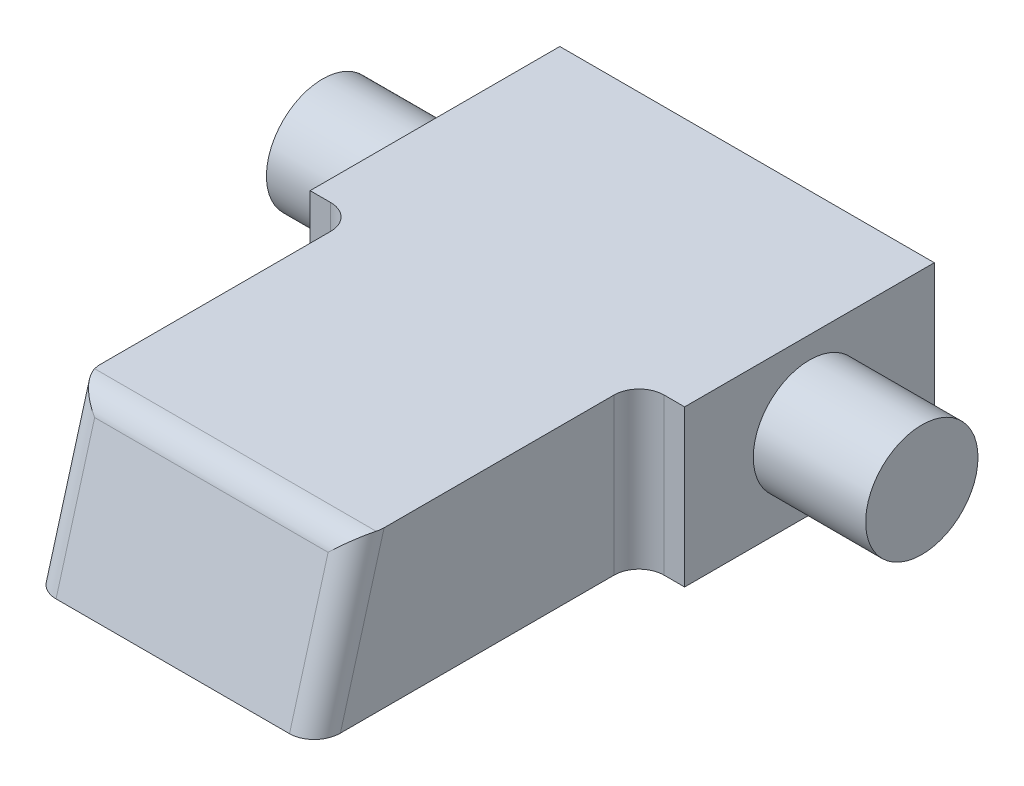
from build123d import *

# Parameters (mm, degrees)
BOSS_EXTRUDE1_DEPTH            = 12.5
CUT_EXTRUDE1_REACH             = 42.954
CUT_EXTRUDE1_DIRECTION_2_REACH = 42.954
FILLET1_R                      = 2
BOSS_EXTRUDE2_DEPTH            = 24
BOSS_EXTRUDE2_DEPTH_BACK       = 24
SKETCH3_R                      = 4.5


with BuildPart() as part:
    # Sketch1 → Boss-Extrude1 (new body)
    with BuildSketch(Plane(origin=(0, 0, 0), x_dir=(1, 0, 0), z_dir=(0, 1, 0))):
        with BuildLine():
            Line((13.35, -10), (15, -10))
            Line((15, -10), (15, 10))
            Line((15, 10), (-15, 10))
            Line((-15, 10), (-15, -10))
            Line((-15, -10), (-13.35, -10))
            ThreePointArc((-13.35, -10), (-11.935786438, -10.585786438), (-11.35, -12))
            Line((-11.35, -12), (-11.35, -36))
            Line((-11.35, -36), (11.35, -36))
            Line((11.35, -36), (11.35, -12))
            ThreePointArc((11.35, -12), (11.935786438, -10.585786438), (13.35, -10))
        make_face()
    extrude(amount=BOSS_EXTRUDE1_DEPTH)

    # Cut-Extrude1: up to this face of the body (flat: up to its plane)
    cut_extrude1_end = Plane(part.part.faces().sort_by_distance((-11.35, 6.25, 24))[0])
    # Sketch2 → Cut-Extrude1 (cut, up to the picked face)
    with BuildSketch(Plane(origin=(0, 0, 0), x_dir=(0, 0, -1), z_dir=(1, 0, 0)), mode=Mode.PRIVATE) as cut_extrude1_sk1:
        Polygon((-36, 0), (-32.5, 12.5), (-36, 12.5), align=None)
    cut_extrude1_tool1 = split(extrude(cut_extrude1_sk1.sketch, amount=-CUT_EXTRUDE1_REACH, mode=Mode.PRIVATE), bisect_by=cut_extrude1_end, keep=Keep.BOTH, mode=Mode.PRIVATE)
    add(cut_extrude1_tool1.solids().sort_by(Axis((0, 8.333333, 34.833333), (-1, 0, 0)))[0], mode=Mode.SUBTRACT)

    # Cut-Extrude1 direction 2: up to this face of the body (flat: up to its plane)
    cut_extrude1_direction_2_end = Plane(part.part.faces().sort_by_distance((11.35, 6.25, 24))[0])
    # Sketch2 → Cut-Extrude1 direction 2 (cut, up to the picked face)
    with BuildSketch(Plane(origin=(0, 0, 0), x_dir=(0, 0, -1), z_dir=(1, 0, 0)), mode=Mode.PRIVATE) as cut_extrude1_direction_2_sk1:
        Polygon((-36, 0), (-32.5, 12.5), (-36, 12.5), align=None)
    cut_extrude1_direction_2_tool1 = split(extrude(cut_extrude1_direction_2_sk1.sketch, amount=CUT_EXTRUDE1_DIRECTION_2_REACH, mode=Mode.PRIVATE), bisect_by=cut_extrude1_direction_2_end, keep=Keep.BOTH, mode=Mode.PRIVATE)
    add(cut_extrude1_direction_2_tool1.solids().sort_by(Axis((0, 8.333333, 34.833333), (1, 0, 0)))[0], mode=Mode.SUBTRACT)

    # Fillet1
    fillet1_edges = [part.edges().sort_by_distance(p)[0] for p in [
        (0, 12.5, 32.5),
        (11.35, 6.25, 34.25),
        (-11.35, 6.25, 34.25),
    ]]
    fillet(fillet1_edges, radius=FILLET1_R)

    # Sketch3 → Boss-Extrude2 (add, two sides: drawn at the far end of the back side and taken through both)
    with BuildSketch(Plane(origin=(0, 0, 0), x_dir=(0, 0, -1), z_dir=(1, 0, 0)).offset(-BOSS_EXTRUDE2_DEPTH_BACK)):
        with Locations((0, 6.25)):
            Circle(SKETCH3_R)
    extrude(amount=BOSS_EXTRUDE2_DEPTH + BOSS_EXTRUDE2_DEPTH_BACK)


solid = part.part
